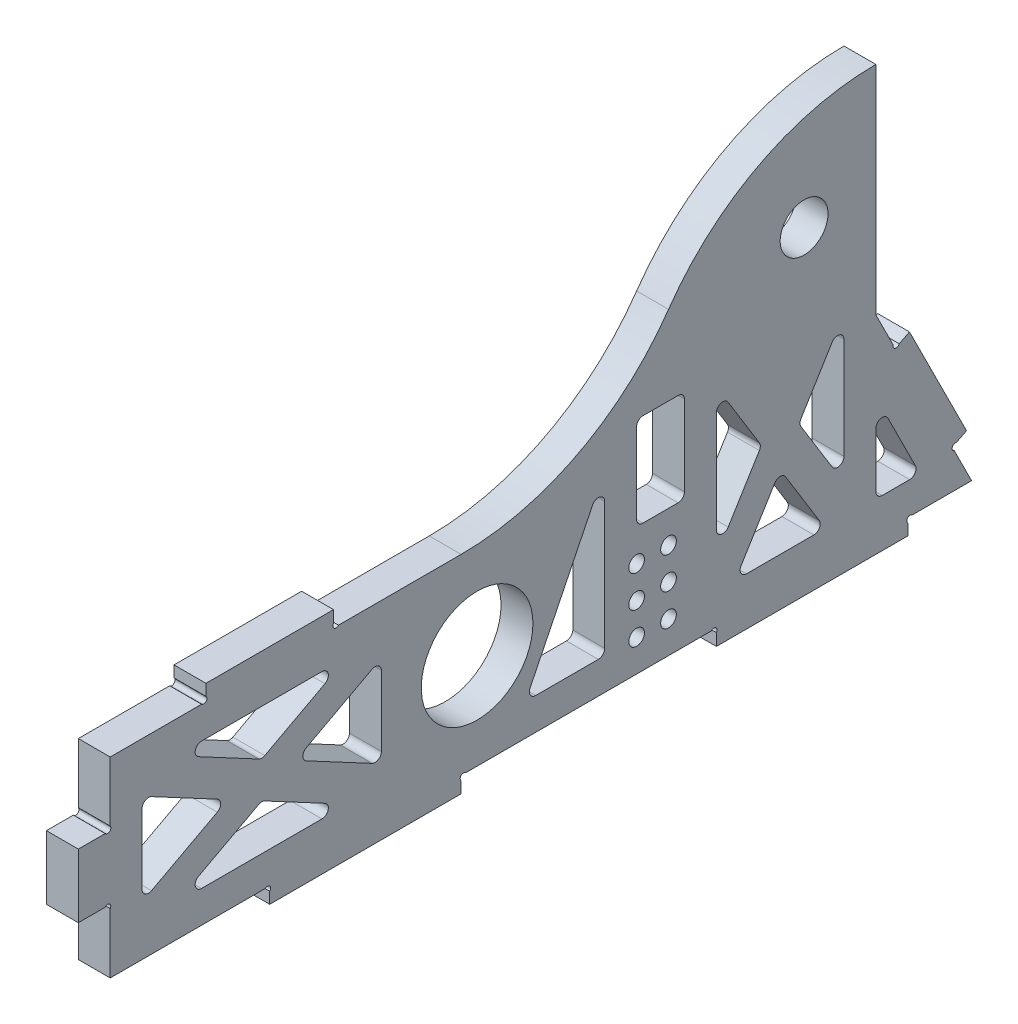
from build123d import *

# Parameters (mm, degrees)
BOSS_EXTRUDE1_DEPTH = 12.7
SKETCH2_R           = 9.525
CUT_EXTRUDE1_DEPTH  = 218.403821494
SKETCH3_W           = 76.2
SKETCH3_H           = 6.35
SKETCH3_W_2         = 12.7
SKETCH3_H_2         = 25.4
BOSS_EXTRUDE2_DEPTH = 12.7
SKETCH9_R           = 22.225
CUT_EXTRUDE4_DEPTH  = 218.403821494
CUT_EXTRUDE6_DEPTH  = 218.403821494
BOSS_EXTRUDE3_DEPTH = 12.7
SKETCH15_R          = 1.27
CUT_EXTRUDE8_DEPTH  = 218.403821494
SKETCH13_R          = 3.126994
SKETCH13_W          = 19.05
SKETCH13_H          = 36.998088235
CUT_EXTRUDE9_DEPTH  = 218.403821494
FILLET1_R           = 2.54
FILLET2_R           = 2.54


with BuildPart() as part:
    # Sketch1 → Boss-Extrude1 (new body)
    with BuildSketch(Plane(origin=(0, 0, 0), x_dir=(0, 0, -1), z_dir=(1, 0, 0))):
        with BuildLine():
            ThreePointArc((57.15, 81.28), (21.180615335, 49.546911859), (-25.4, 38.1))
            Line((-25.4, 38.1), (-76.2, 38.1))
            Line((-76.2, 38.1), (-76.2, 44.45))
            Line((-76.2, 44.45), (-127, 44.45))
            Line((-127, 44.45), (-127, 38.1))
            Line((-127, 38.1), (-165.1, 38.1))
            Line((-165.1, 38.1), (-165.1, -38.1))
            Line((-165.1, -38.1), (177.8, -38.1))
            Line((177.8, -38.1), (139.7, 38.1))
            Line((139.7, 38.1), (139.7, 124.46))
            ThreePointArc((139.7, 124.46), (93.119384665, 113.013088141), (57.15, 81.28))
        make_face()
    extrude(amount=BOSS_EXTRUDE1_DEPTH)

    # Sketch2 → Cut-Extrude1 (cut, through all)
    with BuildSketch(Plane(origin=(12.7, 0, 0), x_dir=(0, 0, -1), z_dir=(1, 0, 0))):
        with Locations((111.125, 82.55)):
            Circle(SKETCH2_R)
    extrude(amount=-CUT_EXTRUDE1_DEPTH, mode=Mode.SUBTRACT)

    # Sketch3 → Boss-Extrude2 (add)
    with BuildSketch(Plane(origin=(12.7, 0, 0), x_dir=(0, 0, -1), z_dir=(1, 0, 0))):
        with Locations((114.3, -41.275)):
            Rectangle(SKETCH3_W, SKETCH3_H)
        with Locations((-63.5, -41.275)):
            Rectangle(SKETCH3_W, SKETCH3_H)
        with Locations((-171.45, 0)):
            Rectangle(SKETCH3_W_2, SKETCH3_H_2)
    extrude(amount=-BOSS_EXTRUDE2_DEPTH)

    # Sketch9 → Cut-Extrude4 (cut, through all)
    with BuildSketch(Plane(origin=(12.7, 0, 0), x_dir=(0, 0, -1), z_dir=(1, 0, 0))):
        with Locations((-19.05, 0)):
            Circle(SKETCH9_R)
    extrude(amount=-CUT_EXTRUDE4_DEPTH, mode=Mode.SUBTRACT)

    # Sketch12 → Cut-Extrude6 (cut, through all)
    with BuildSketch(Plane(origin=(12.7, 0, 0), x_dir=(0, 0, -1), z_dir=(1, 0, 0))):
        Polygon((139.7, 9.701936686), (139.7, -25.4), (157.250968343, -25.4), align=None)
        Polygon((109.05604179, 15.875), (127, -13.283932092), (127, 45.033932092), align=None)
        Polygon((119.54395821, -25.4), (101.6, 3.758932092), (83.65604179, -25.4), align=None)
        Polygon((76.2, -13.283932092), (94.14395821, 15.875), (76.2, 45.033932092), align=None)
        Polygon((-57.15, -18.203333333), (-57.15, 18.203333333), (-91.28125, 0), align=None)
        Polygon((-70.64375, -25.4), (-104.775, -7.196666667), (-138.90625, -25.4), align=None)
        Polygon((-152.4, -18.203333333), (-118.26875, 0), (-152.4, 18.203333333), align=None)
        Polygon((-104.775, 7.196666667), (-70.64375, 25.4), (-138.90625, 25.4), align=None)
    extrude(amount=-CUT_EXTRUDE6_DEPTH, mode=Mode.SUBTRACT)

    # Sketch14 → Boss-Extrude3 (add)
    with BuildSketch(Plane(origin=(12.7, 0, 0), x_dir=(0, 0, -1), z_dir=(1, 0, 0))):
        Polygon((147.390774674, 22.718450651), (170.109225326, -22.718450651), (175.788837989, -19.87864432), (153.070387337, 25.558256983), align=None)
    extrude(amount=-BOSS_EXTRUDE3_DEPTH)

    # Sketch15 → Cut-Extrude8 (cut, through all)
    with BuildSketch(Plane(origin=(12.7, 0, 0), x_dir=(0, 0, -1), z_dir=(1, 0, 0))):
        with Locations((-166.14759319, -13.417947427)):
            Circle(SKETCH15_R)
        with Locations((-127.867535363, 39.027514093)):
            Circle(SKETCH15_R)
        with Locations((-102.468735692, -39.026389927)):
            Circle(SKETCH15_R)
        with Locations((75.20280066, -38.886443562)):
            Circle(SKETCH15_R)
        with Locations((153.276127819, -39.019402004)):
            Circle(SKETCH15_R)
        with Locations((-24.501616142, -38.997667224)):
            Circle(SKETCH15_R)
        with Locations((-166.09635678, 13.487510741)):
            Circle(SKETCH15_R)
        with Locations((-75.205348286, 38.8896632)):
            Circle(SKETCH15_R)
        with Locations((171.314053114, -23.120059914)):
            Circle(SKETCH15_R)
        with Locations((147.792383937, 23.92327844)):
            Circle(SKETCH15_R)
    extrude(amount=-CUT_EXTRUDE8_DEPTH, mode=Mode.SUBTRACT)

    # Sketch13 → Cut-Extrude9 (cut, through all)
    with BuildSketch(Plane(origin=(12.7, 0, 0), x_dir=(0, 0, -1), z_dir=(1, 0, 0))):
        with Locations((44.45, -25.4)):
            Circle(SKETCH13_R)
        with Locations((57.15, -25.4)):
            Circle(SKETCH13_R)
        with Locations((44.45, -12.7)):
            Circle(SKETCH13_R)
        with Locations((57.15, -12.7)):
            Circle(SKETCH13_R)
        with Locations((44.45, 0)):
            Circle(SKETCH13_R)
        with Locations((57.15, 0)):
            Circle(SKETCH13_R)
        with Locations((53.975, 31.199044118)):
            Rectangle(SKETCH13_W, SKETCH13_H)
        Polygon((31.75, -25.4), (31.75, 38.736971741), (0.2156773, -25.4), align=None)
    extrude(amount=-CUT_EXTRUDE9_DEPTH, mode=Mode.SUBTRACT)

    # Fillet1
    fillet1_edges = [part.edges().sort_by_distance(p)[0] for p in [
        (6.35, -25.4, -139.7),
        (6.35, 9.701936686, -139.7),
        (6.35, -25.4, -157.250968343),
        (6.35, 0, 118.26875),
        (6.35, -18.203333333, 152.4),
        (6.35, 18.203333333, 152.4),
        (6.35, -25.4, 70.64375),
        (6.35, -25.4, 138.90625),
        (6.35, -7.196666667, 104.775),
        (6.35, 7.196666667, 104.775),
        (6.35, 25.4, 138.90625),
        (6.35, 25.4, 70.64375),
        (6.35, 3.758932092, -101.6),
        (6.35, -25.4, -119.54395821),
        (6.35, -25.4, -83.65604179),
        (6.35, 45.033932092, -127),
        (6.35, -13.283932092, -127),
        (6.35, 15.875, -109.05604179),
        (6.35, 15.875, -94.14395821),
        (6.35, -13.283932092, -76.2),
        (6.35, 45.033932092, -76.2),
        (6.35, 18.203333333, 57.15),
        (6.35, -18.203333333, 57.15),
        (6.35, 0, 91.28125),
    ]]
    fillet(fillet1_edges, radius=FILLET1_R)

    # Fillet2
    fillet2_edges = [part.edges().sort_by_distance(p)[0] for p in [
        (6.35, -25.4, -31.75),
        (6.35, -25.4, -0.2156773),
        (6.35, 38.736971741, -31.75),
        (6.35, 49.698088235, -63.5),
        (6.35, 12.7, -63.5),
        (6.35, 12.7, -44.45),
        (6.35, 49.698088235, -44.45),
    ]]
    fillet(fillet2_edges, radius=FILLET2_R)


solid = part.part
